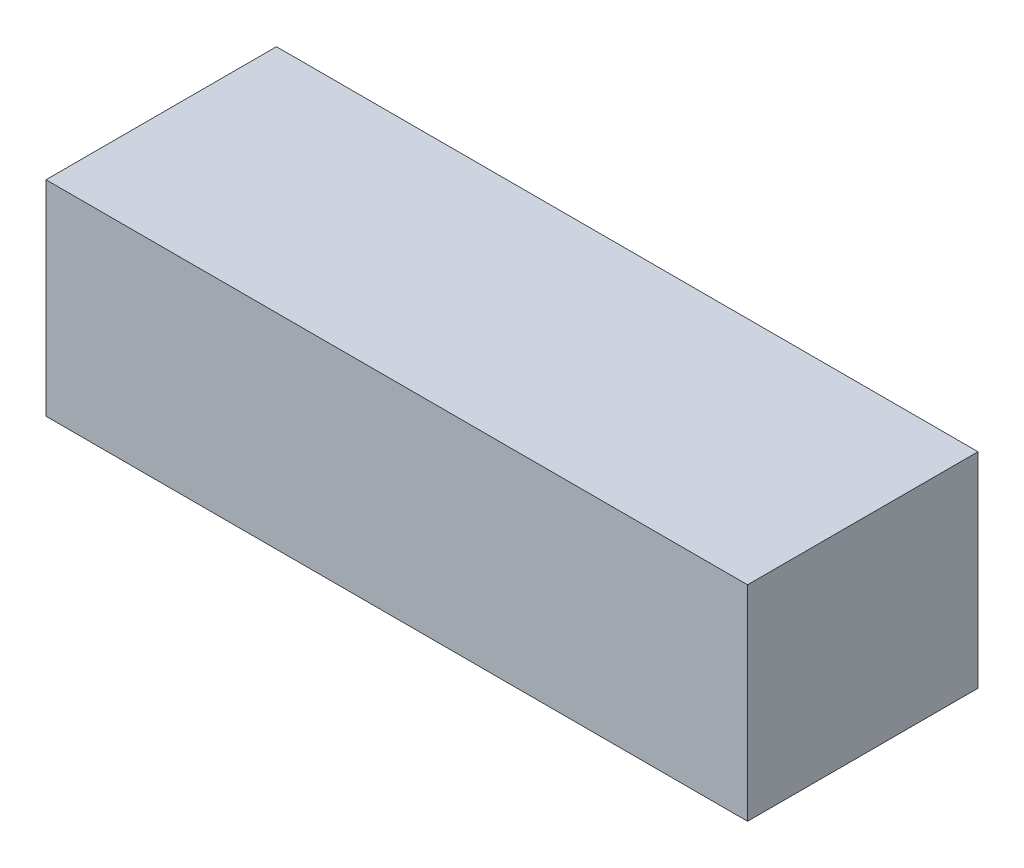
from build123d import *

# Parameters (mm, degrees)
SKETCH1_W           = 137
SKETCH1_H           = 40
BOSS_EXTRUDE1_DEPTH = 22.5


with BuildPart() as part:
    # Sketch1 → Boss-Extrude1 (new, symmetric)
    with BuildSketch(Plane.XY):
        with Locations((6.216941494, -2.174304419)):
            Rectangle(SKETCH1_W, SKETCH1_H)
    extrude(amount=BOSS_EXTRUDE1_DEPTH, both=True)


solid = part.part
